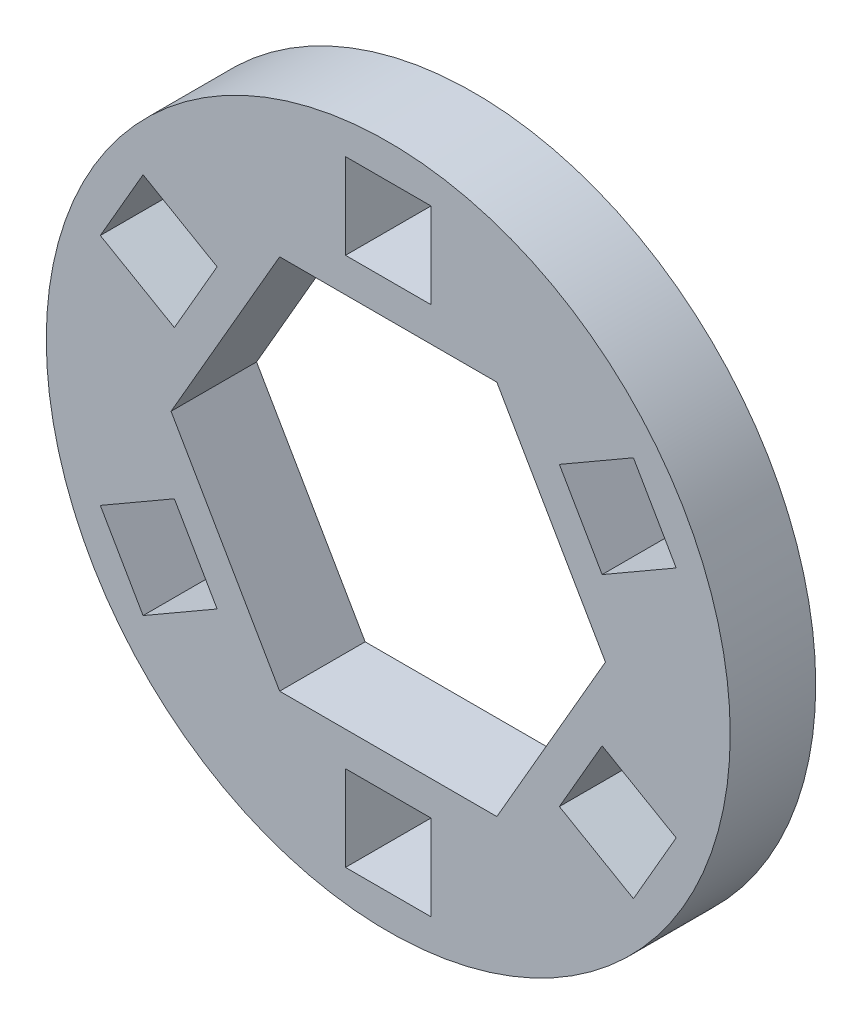
from build123d import *

# Parameters (mm, degrees)
SKETCH1_R           = 20
SKETCH1_W           = 5
SKETCH1_H           = 5
BOSS_EXTRUDE1_DEPTH = 5


with BuildPart() as part:
    # Sketch1 → Boss-Extrude1 (new body)
    with BuildSketch(Plane.XY):
        Circle(SKETCH1_R)
        Polygon((12.701705922, 0), (6.350852961, 11), (-6.350852961, 11), (-12.701705922, 0), (-6.350852961, -11), (6.350852961, -11), align=None, mode=Mode.SUBTRACT)
        with Locations((0, 15.5)):
            Rectangle(SKETCH1_W, SKETCH1_H, mode=Mode.SUBTRACT)
        Polygon((16.838457268, 6.834936491), (12.508330249, 4.334936491), (10.008330249, 8.665063509), (14.338457268, 11.165063509), align=None, mode=Mode.SUBTRACT)
        Polygon((14.338457268, -11.165063509), (10.008330249, -8.665063509), (12.508330249, -4.334936491), (16.838457268, -6.834936491), align=None, mode=Mode.SUBTRACT)
        with Locations((0, -15.5)):
            Rectangle(SKETCH1_W, SKETCH1_H, mode=Mode.SUBTRACT)
        Polygon((-16.838457268, -6.834936491), (-12.508330249, -4.334936491), (-10.008330249, -8.665063509), (-14.338457268, -11.165063509), align=None, mode=Mode.SUBTRACT)
        Polygon((-14.338457268, 11.165063509), (-10.008330249, 8.665063509), (-12.508330249, 4.334936491), (-16.838457268, 6.834936491), align=None, mode=Mode.SUBTRACT)
    extrude(amount=BOSS_EXTRUDE1_DEPTH)


solid = part.part
